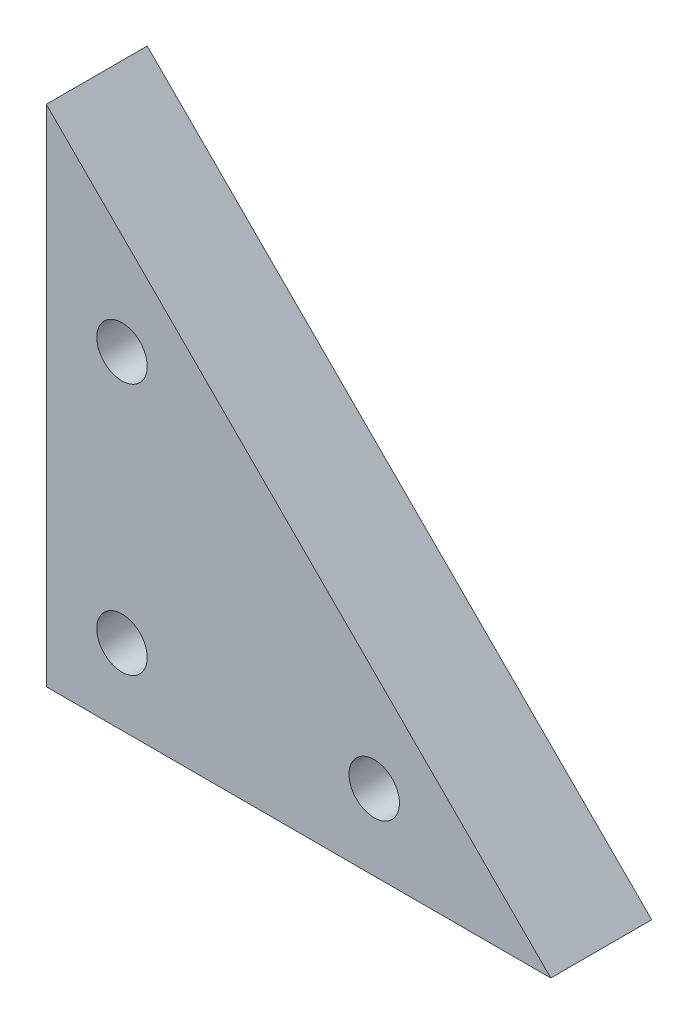
from build123d import *

# Parameters (mm, degrees)
BOSS_EXTRUDE1_DEPTH = 20
SKETCH2_R           = 5
CUT_EXTRUDE1_DEPTH  = 20


with BuildPart() as part:
    # Sketch1 → Boss-Extrude1 (new body)
    with BuildSketch(Plane.XY):
        Polygon((0, 0), (100, 0), (0, 100), align=None)
    extrude(amount=BOSS_EXTRUDE1_DEPTH)

    # Sketch2 → Cut-Extrude1 (cut)
    with BuildSketch(Plane.XY.offset(20)):
        with Locations((15, 65)):
            Circle(SKETCH2_R)
        with Locations((15, 15)):
            Circle(SKETCH2_R)
        with Locations((65, 15)):
            Circle(SKETCH2_R)
    extrude(amount=-CUT_EXTRUDE1_DEPTH, mode=Mode.SUBTRACT)


solid = part.part
